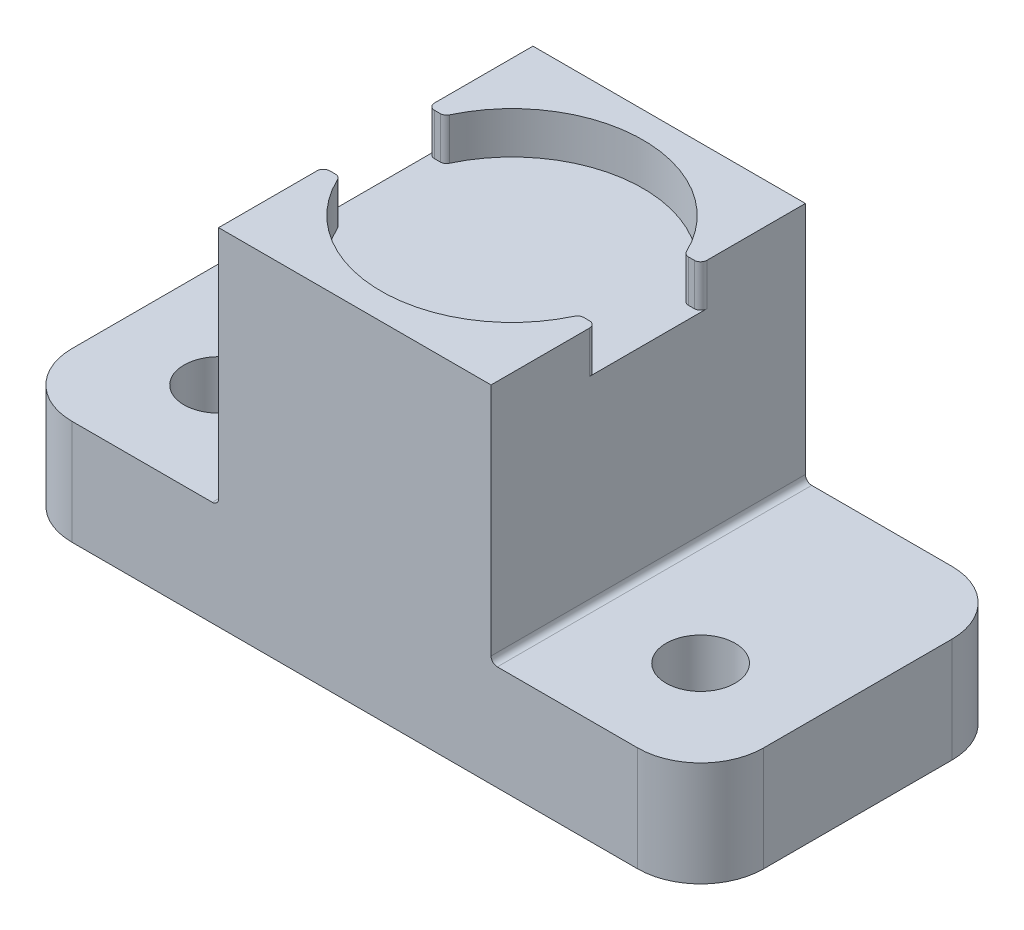
from build123d import *

# Parameters (mm, degrees)
SKETCH_1_W          = 33
SKETCH_1_H          = 5
SKETCH_1_W_2        = 13
SKETCH_1_H_2        = 11.5
EXTRUDE_1_DEPTH     = 15
SKETCH_2_R          = 1.65
CUT_EXTRUDE_1_DEPTH = 26.089838581
CUT_EXTRUDE_3_DEPTH = 2
FILLET_2_R          = 0.3
FILLET_3_R          = 0.3
FILLET_4_R          = 3


with BuildPart() as part:
    # ｽｹｯﾁ1 → ﾎﾞｽ - 押し出し1 (new body)
    with BuildSketch(Plane.XY):
        Rectangle(SKETCH_1_W, SKETCH_1_H)
        with Locations((0, 8.25)):
            Rectangle(SKETCH_1_W_2, SKETCH_1_H_2)
    extrude(amount=EXTRUDE_1_DEPTH)

    # ｽｹｯﾁ2 → ｶｯﾄ - 押し出し1 (cut, through all)
    with BuildSketch(Plane(origin=(0, 2.5, 0), x_dir=(1, 0, 0), z_dir=(0, 1, 0))):
        with Locations(Location((-11.5, -10, 0), (0, 0, 180))):
            Circle(SKETCH_2_R)
        with Locations((11.5, -10)):
            Circle(SKETCH_2_R)
    extrude(amount=-CUT_EXTRUDE_1_DEPTH, mode=Mode.SUBTRACT)

    # ｽｹｯﾁ3 → ｶｯﾄ - 押し出し3 (cut)
    with BuildSketch(Plane(origin=(0, 14, 0), x_dir=(1, 0, 0), z_dir=(0, 1, 0))):
        with BuildLine():
            Line((-5.728219619, -5), (5.728219619, -5))
            ThreePointArc((5.728219619, -5), (0, -1.25), (-5.728219619, -5))
        make_face()
        with BuildLine():
            ThreePointArc((-5.728219619, -10), (0, -13.75), (5.728219619, -10))
            Line((5.728219619, -10), (-5.728219619, -10))
        make_face()
        with BuildLine():
            ThreePointArc((6.25, -7.5), (6.118164456, -6.223064727), (5.728219619, -5))
            Line((5.728219619, -5), (-5.728219619, -5))
            ThreePointArc((-5.728219619, -5), (-6.25, -7.5), (-5.728219619, -10))
            Line((-5.728219619, -10), (5.728219619, -10))
            ThreePointArc((5.728219619, -10), (6.118164456, -8.776935273), (6.25, -7.5))
        make_face()
        with BuildLine():
            ThreePointArc((-5.728219619, -10), (-6.25, -7.5), (-5.728219619, -5))
            Line((-5.728219619, -5), (-6.5, -5))
            Line((-6.5, -5), (-6.5, -10))
            Line((-6.5, -10), (-5.728219619, -10))
        make_face()
        with BuildLine():
            Line((6.5, -10), (6.5, -5))
            Line((6.5, -5), (5.728219619, -5))
            ThreePointArc((5.728219619, -5), (6.118164456, -6.223064727), (6.25, -7.5))
            ThreePointArc((6.25, -7.5), (6.118164456, -8.776935273), (5.728219619, -10))
            Line((5.728219619, -10), (6.5, -10))
        make_face()
    extrude(amount=-CUT_EXTRUDE_3_DEPTH, mode=Mode.SUBTRACT)

    # ﾌｨﾚｯﾄ2
    fillet_2_edges = [part.edges().sort_by_distance(p)[0] for p in [
        (-5.728219619, 13, 5),
        (5.728219619, 13, 5),
        (6.5, 13, 5),
        (6.5, 13, 10),
        (5.728219619, 13, 10),
        (-5.728219619, 13, 10),
        (-6.5, 13, 10),
        (-6.5, 13, 5),
    ]]
    fillet(fillet_2_edges, radius=FILLET_2_R)

    # ﾌｨﾚｯﾄ3
    fillet_3_edges = [part.edges().sort_by_distance(p)[0] for p in [
        (-6.5, 2.5, 7.5),
        (6.5, 2.5, 7.5),
    ]]
    fillet(fillet_3_edges, radius=FILLET_3_R)

    # ﾌｨﾚｯﾄ4
    fillet_4_edges = [part.edges().sort_by_distance(p)[0] for p in [
        (-16.5, 0, 0),
        (-16.5, 0, 15),
        (16.5, 0, 15),
        (16.5, 0, 0),
    ]]
    fillet(fillet_4_edges, radius=FILLET_4_R)


solid = part.part
